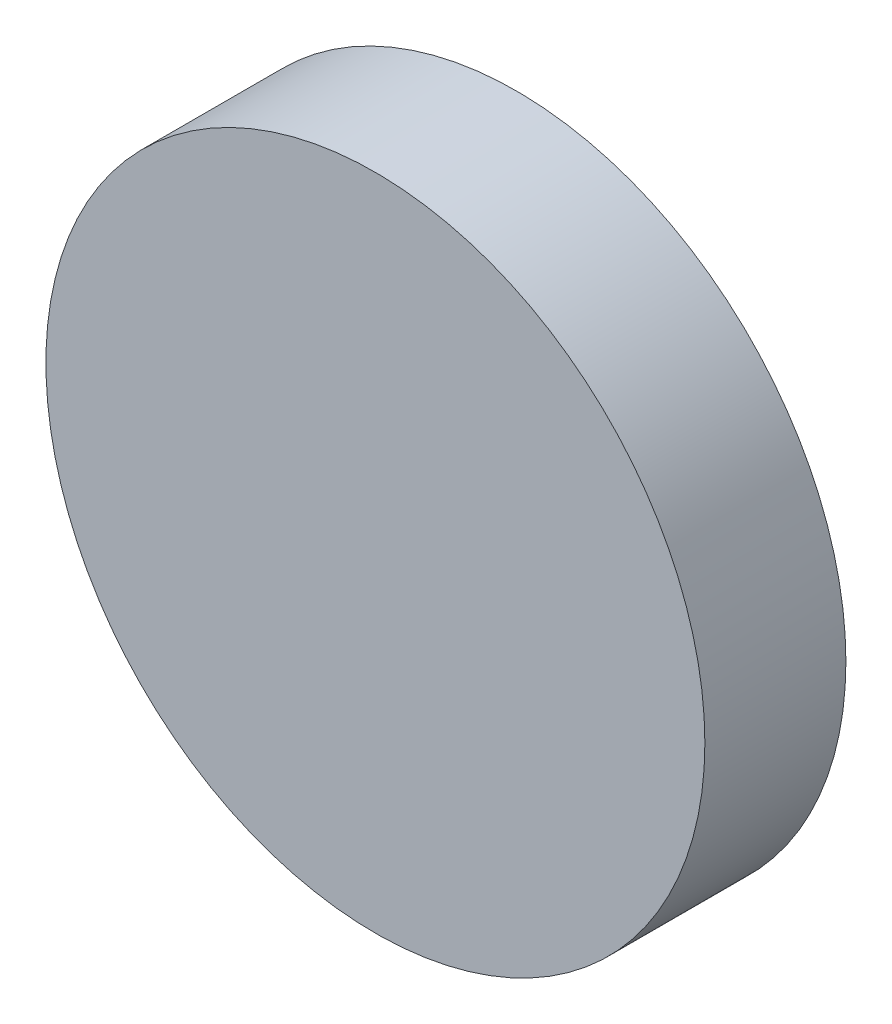
from build123d import *

# Parameters (mm, degrees)
MODEL_R             = 12.5
BOSS_EXTRUDE1_DEPTH = 5.35


with BuildPart() as part:
    # Model → Boss-Extrude1 (new body)
    with BuildSketch(Plane.XY):
        with Locations((12.5, 12.5)):
            Circle(MODEL_R)
    extrude(amount=BOSS_EXTRUDE1_DEPTH)


solid = part.part
